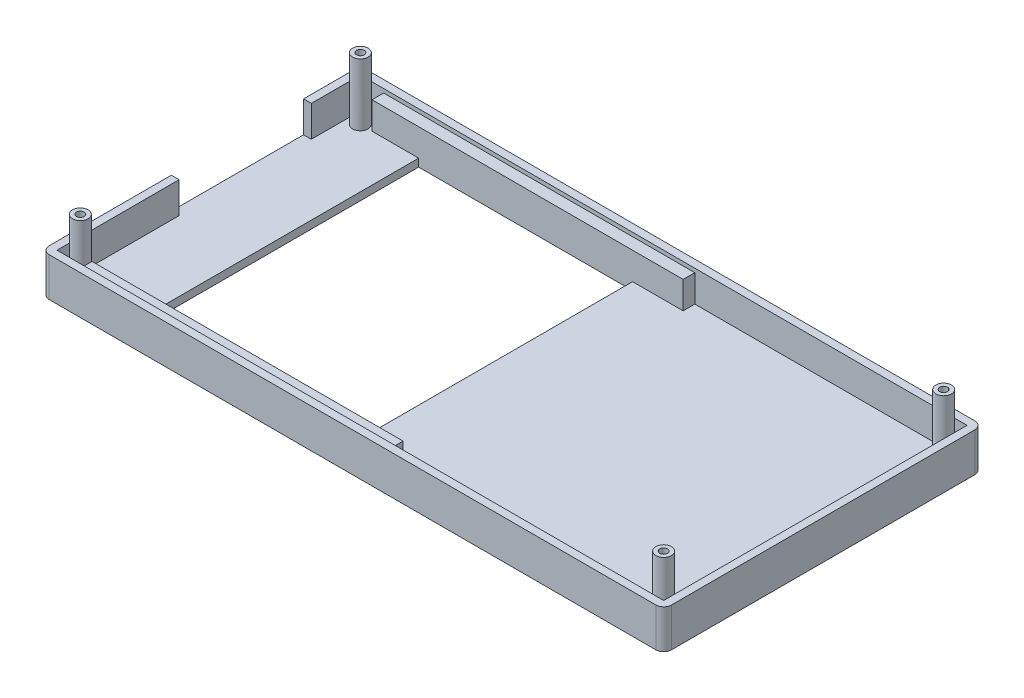
from build123d import *

# Parameters (mm, degrees)
SKETCH1_W           = 160
SKETCH1_H           = 82
BOSS_EXTRUDE1_DEPTH = 10
SHELL1_T            = -2
FILLET1_R           = 2
FILLET2_R           = 2
FILLET3_R           = 2
FILLET4_R           = 2
SKETCH10_W          = 34
SKETCH10_H          = 8.029729716
CUT_EXTRUDE1_DEPTH  = 6
SKETCH2_R           = 2
SKETCH2_R_2         = 1
BOSS_EXTRUDE7_DEPTH = 16
SKETCH12_W          = 80
SKETCH12_H          = 3
BOSS_EXTRUDE8_DEPTH = 7
SKETCH13_W          = 55
SKETCH13_H          = 72
CUT_EXTRUDE3_DEPTH  = 200


with BuildPart() as part:
    # Sketch1 → Boss-Extrude1 (new body)
    with BuildSketch(Plane(origin=(0, 0, 0), x_dir=(1, 0, 0), z_dir=(0, 1, 0))):
        Rectangle(SKETCH1_W, SKETCH1_H)
    extrude(amount=BOSS_EXTRUDE1_DEPTH)

    # Shell1
    shell1_openings = [part.faces().sort_by_distance(p)[0] for p in [
        (0, 10, 0),
    ]]
    offset(amount=SHELL1_T, openings=shell1_openings, kind=Kind.INTERSECTION)

    # Fillet1
    fillet1_edges = [part.edges().sort_by_distance(p)[0] for p in [
        (-80, 5, 41),
    ]]
    fillet(fillet1_edges, radius=FILLET1_R)

    # Fillet2
    fillet2_edges = [part.edges().sort_by_distance(p)[0] for p in [
        (-80, 5, -41),
    ]]
    fillet(fillet2_edges, radius=FILLET2_R)

    # Fillet3
    fillet3_edges = [part.edges().sort_by_distance(p)[0] for p in [
        (80, 5, -41),
    ]]
    fillet(fillet3_edges, radius=FILLET3_R)

    # Fillet4
    fillet4_edges = [part.edges().sort_by_distance(p)[0] for p in [
        (80, 5, 41),
    ]]
    fillet(fillet4_edges, radius=FILLET4_R)

    # Sketch10 → Cut-Extrude1 (cut)
    with BuildSketch(Plane.ZY.offset(80)):
        with Locations((-9.4, 6.014864858)):
            Rectangle(SKETCH10_W, SKETCH10_H)
    extrude(amount=-CUT_EXTRUDE1_DEPTH, mode=Mode.SUBTRACT)

    # Sketch2 → Boss-Extrude7 (add)
    # profile 1 of 4: a face of its own
    with BuildSketch(Plane(origin=(0, 2, 0), x_dir=(1, 0, 0), z_dir=(0, 1, 0))):
        with Locations(Location((-75, 36, 0), (0, 0, 90))):
            Circle(SKETCH2_R)
        with Locations(Location((-75, 36, 0), (0, 0, 270))):
            Circle(SKETCH2_R_2, mode=Mode.SUBTRACT)
    # profile 2 of 4: a face of its own
    with BuildSketch(Plane(origin=(0, 2, 0), x_dir=(1, 0, 0), z_dir=(0, 1, 0))):
        with Locations(Location((75, 36, 0), (0, 0, 90))):
            Circle(SKETCH2_R)
        with Locations(Location((75, 36, 0), (0, 0, 90))):
            Circle(SKETCH2_R_2, mode=Mode.SUBTRACT)
    # profile 3 of 4: a face of its own
    with BuildSketch(Plane(origin=(0, 2, 0), x_dir=(1, 0, 0), z_dir=(0, 1, 0))):
        with Locations(Location((-75, -36, 0), (0, 0, 90))):
            Circle(SKETCH2_R)
        with Locations(Location((-75, -36, 0), (0, 0, 90))):
            Circle(SKETCH2_R_2, mode=Mode.SUBTRACT)
    # profile 4 of 4: a face of its own
    with BuildSketch(Plane(origin=(0, 2, 0), x_dir=(1, 0, 0), z_dir=(0, 1, 0))):
        with Locations(Location((75, -36, 0), (0, 0, 90))):
            Circle(SKETCH2_R)
        with Locations(Location((75, -36, 0), (0, 0, 270))):
            Circle(SKETCH2_R_2, mode=Mode.SUBTRACT)
    extrude(amount=BOSS_EXTRUDE7_DEPTH)

    # Sketch12 → Boss-Extrude8 (add)
    with BuildSketch(Plane(origin=(0, 2, 0), x_dir=(1, 0, 0), z_dir=(0, 1, 0))):
        with Locations((-32, 37.5)):
            Rectangle(SKETCH12_W, SKETCH12_H)
        with Locations((-32, -37.5)):
            Rectangle(SKETCH12_W, SKETCH12_H)
    extrude(amount=BOSS_EXTRUDE8_DEPTH)

    # Sketch13 → Cut-Extrude3 (cut)
    with BuildSketch(Plane(origin=(0, 2, 0), x_dir=(1, 0, 0), z_dir=(0, 1, 0))):
        with Locations((-32.5, 0)):
            Rectangle(SKETCH13_W, SKETCH13_H)
    extrude(amount=-CUT_EXTRUDE3_DEPTH, mode=Mode.SUBTRACT)


solid = part.part
